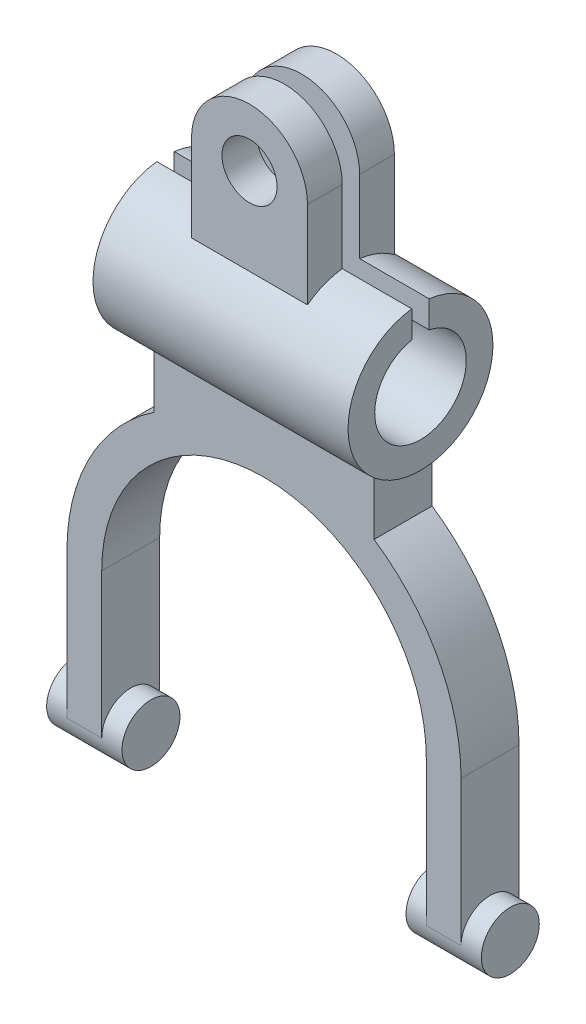
from build123d import *

# Parameters (mm, degrees)
SKETCH1_R           = 12.5
BOSS_EXTRUDE1_DEPTH = 22
SKETCH2_R           = 4.75
BOSS_EXTRUDE2_DEPTH = 7.5
BOSS_EXTRUDE3_DEPTH = 5
BOSS_EXTRUDE4_START = -9.5
SKETCH5_R           = 5
BOSS_EXTRUDE4_DEPTH = 13
SKETCH4_R           = 7.9
SKETCH4_W           = 3
SKETCH4_H           = 38
CUT_EXTRUDE1_DEPTH  = 101.481341552


with BuildPart() as part:
    # Sketch1 → Boss-Extrude1 (new, symmetric)
    with BuildSketch(Plane(origin=(0, 0, 0), x_dir=(0, 0, -1), z_dir=(1, 0, 0))):
        Circle(SKETCH1_R)
    extrude(amount=BOSS_EXTRUDE1_DEPTH, both=True)

    # Sketch2 → Boss-Extrude2 (add, symmetric)
    with BuildSketch(Plane.XY):
        with BuildLine():
            Line((-10, 25), (-10, 0))
            Line((-10, 0), (10, 0))
            Line((10, 0), (10, 25))
            ThreePointArc((10, 25), (0, 35), (-10, 25))
        make_face()
        with Locations((0, 25)):
            Circle(SKETCH2_R, mode=Mode.SUBTRACT)
    extrude(amount=BOSS_EXTRUDE2_DEPTH, both=True)

    # Sketch3 → Boss-Extrude3 (add, symmetric)
    with BuildSketch(Plane.XY):
        with BuildLine():
            Line((-28, -50), (-28, -75))
            Line((-28, -75), (-34, -75))
            Line((-34, -75), (-34, -50))
            ThreePointArc((-34, -50), (-30.01666204, -34.031280577), (-19, -21.80425564))
            Line((-19, -21.80425564), (-19, -8.5))
            Line((-19, -8.5), (19, -8.5))
            Line((19, -8.5), (19, -21.80425564))
            ThreePointArc((19, -21.80425564), (30.01666204, -34.031280577), (34, -50))
            Line((34, -50), (34, -75))
            Line((34, -75), (28, -75))
            Line((28, -75), (28, -50))
            ThreePointArc((28, -50), (0, -22), (-28, -50))
        make_face()
    extrude(amount=BOSS_EXTRUDE3_DEPTH, both=True)

    # Sketch5 → Boss-Extrude4 (add)
    with BuildSketch(Plane(origin=(34, 0, 0), x_dir=(0, 0, -1), z_dir=(1, 0, 0)).offset(BOSS_EXTRUDE4_START)):
        with Locations((0, -75)):
            Circle(SKETCH5_R)
    boss_extrude4 = extrude(amount=BOSS_EXTRUDE4_DEPTH)

    # Mirror1: Boss-Extrude4 across plane
    add(boss_extrude4.mirror(Plane(origin=(0, 0, 0), x_dir=(0, 0, 1), z_dir=(1, 0, 0))))

    # Sketch4 → Cut-Extrude1 (cut, through all)
    with BuildSketch(Plane(origin=(22, 0, 0), x_dir=(0, 0, -1), z_dir=(1, 0, 0))):
        Circle(SKETCH4_R)
        with Locations((0, 19)):
            Rectangle(SKETCH4_W, SKETCH4_H)
    extrude(amount=-CUT_EXTRUDE1_DEPTH, mode=Mode.SUBTRACT)


solid = part.part
